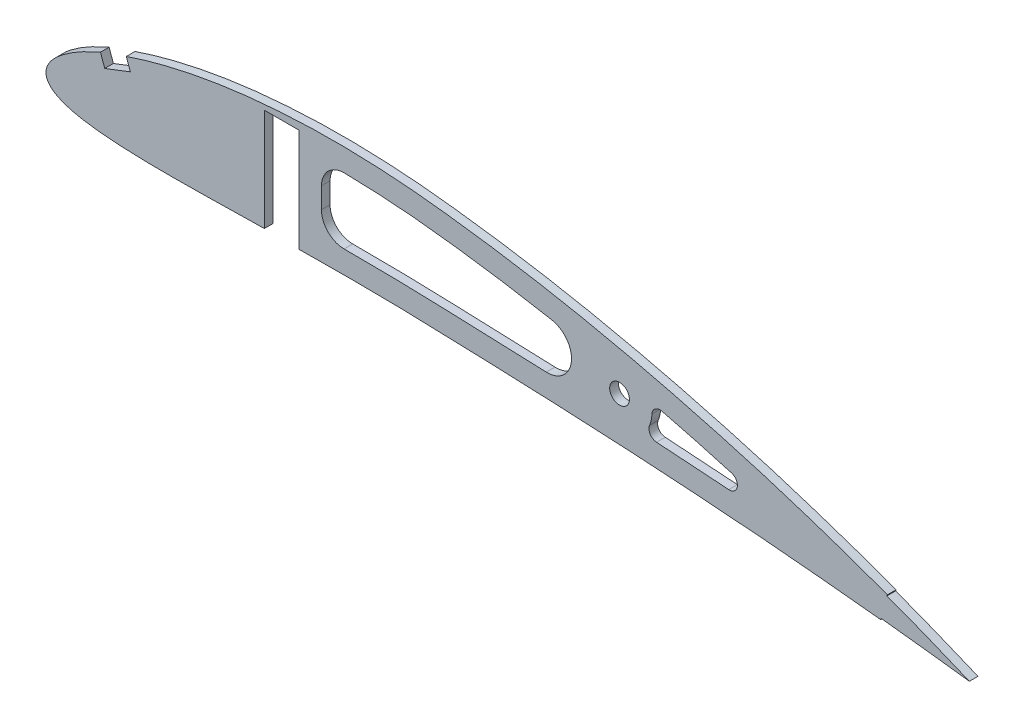
from build123d import *

# Parameters (mm, degrees)
BOSS_EXTRUDE1_DEPTH = 3.4036


with BuildPart() as part:
    # Sketch2 → Boss-Extrude1 (new body)
    with BuildSketch(Plane.XY):
        with BuildLine():
            Line((2535.274805049, 2780.893223643), (2535.274805049, 2740.543361122))
            add(Edge.make_bspline(
                [(2470.766103702, 2768.410457858), (2470.646363815, 2768.358370186), (2470.526712246, 2768.306083676), (2466.913650609, 2766.719977087), (2463.464058775, 2765.044567586), (2457.884399007, 2761.615856063), (2455.608911301, 2760.022433856), (2451.964070041, 2756.675565287), (2450.465728267, 2754.947704601), (2449.289153427, 2751.740968519), (2449.156845546, 2750.440082954), (2449.952027869, 2748.064324238), (2450.809883366, 2747.015100953), (2452.679965619, 2745.532727698), (2453.700996299, 2744.975168564), (2455.737837909, 2744.036068031), (2456.824400221, 2743.665360108), (2460.204069688, 2742.607686032), (2462.568258916, 2742.14769235), (2467.320698583, 2741.37212577), (2469.719825171, 2741.106348945), (2476.948343474, 2740.464859033), (2481.784959026, 2740.2115118), (2491.469537197, 2739.981485553), (2496.312043463, 2739.970228934), (2511.07935418, 2740.05419246), (2520.979134882, 2740.284580717), (2532.350045622, 2740.487337232), (2533.812383917, 2740.515077162), (2535.274805049, 2740.543361122)],
                knots=[14.135708649, 14.135708649, 14.135708649, 14.135708649, 14.151211266, 14.151211266, 14.60418364, 14.60418364, 14.932415743, 14.932415743, 15.199764537, 15.199764537, 15.36293217, 15.36293217, 15.526099802, 15.526099802, 15.662859963, 15.662859963, 15.799620124, 15.799620124, 16.08612483, 16.08612483, 16.372629537, 16.372629537, 16.94563895, 16.94563895, 17.518648363, 17.518648363, 18.689255122, 18.689255122, 18.862005391, 18.862005391, 18.862005391, 18.862005391], degree=3))
            Line((2470.766103702, 2768.410457858), (2472.446764627, 2763.696275266))
            Line((2472.446764627, 2763.696275266), (2482.522098625, 2767.581637536))
            Line((2482.522098625, 2767.581637536), (2480.933451784, 2772.037724527))
            add(Edge.make_bspline(
                [(2780.542520861, 2738.304796601), (2778.297471279, 2739.142019831), (2776.066016024, 2739.994442341), (2771.008325617, 2741.806292996), (2768.18144962, 2742.797529212), (2759.625872554, 2745.848173798), (2753.840462047, 2747.755489462), (2742.238670832, 2751.518458512), (2736.423638946, 2753.367260119), (2724.751445821, 2756.856399923), (2718.882147108, 2758.516262971), (2708.186181794, 2761.475176204), (2703.375708913, 2762.759245987), (2693.688631483, 2765.207206449), (2688.860326868, 2766.449259942), (2679.136671431, 2768.709757651), (2674.257764472, 2769.781661922), (2664.508292075, 2771.926157494), (2659.616809192, 2772.927359188), (2649.829036467, 2774.78903222), (2644.906848922, 2775.708538585), (2635.081058528, 2777.389593315), (2630.134669196, 2778.190987447), (2621.163761513, 2779.504560399), (2617.075894031, 2780.084905445), (2607.950050259, 2781.247235699), (2602.846379088, 2781.820569992), (2592.680866333, 2782.883311443), (2587.583282915, 2783.254135837), (2577.37591978, 2783.863348746), (2572.264211381, 2784.045638297), (2562.055017904, 2784.177120229), (2556.940496788, 2784.131389377), (2546.726345746, 2783.750312928), (2541.620193263, 2783.45333894), (2522.377936656, 2781.865822712), (2508.272533492, 2779.665319702), (2489.975683566, 2774.935155246), (2485.418638544, 2773.582563598), (2480.933451784, 2772.037724527)],
                knots=[1.615826415, 1.615826415, 1.615826415, 1.615826415, 1.89861169, 1.89861169, 2.251569757, 2.251569757, 2.972379576, 2.972379576, 3.693189395, 3.693189395, 4.413999213, 4.413999213, 5.004034628, 5.004034628, 5.594070044, 5.594070044, 6.184105459, 6.184105459, 6.774140874, 6.774140874, 7.364176289, 7.364176289, 7.954211705, 7.954211705, 8.439681123, 8.439681123, 9.044668165, 9.044668165, 9.649655208, 9.649655208, 10.25464225, 10.25464225, 10.859629292, 10.859629292, 11.464616334, 11.464616334, 13.146196735, 13.146196735, 13.708744468, 13.708744468, 13.708744468, 13.708744468], degree=3))
            Line((2780.542520861, 2738.304796601), (2780.366179259, 2737.831929121))
            add(Edge.make_bspline(
                [(2812.811153408, 2724.948946669), (2811.742721472, 2725.395887757), (2810.661000778, 2725.841374778), (2805.162016263, 2728.122214921), (2800.746808293, 2729.909964469), (2791.811027497, 2733.531206027), (2787.390855916, 2735.226750848), (2782.055306735, 2737.205208616), (2781.210779035, 2737.518702972), (2780.366179259, 2737.831929121)],
                knots=[0.240373092, 0.240373092, 0.240373092, 0.240373092, 0.376824745, 0.376824745, 0.94322841, 0.94322841, 1.509632074, 1.509632074, 1.616176715, 1.616176715, 1.616176715, 1.616176715], degree=3))
            add(Edge.make_bspline(
                [(2778.019298543, 2729.044285785), (2779.174843082, 2728.917272472), (2780.33031454, 2728.787786942), (2787.996855373, 2727.910162037), (2794.540348084, 2727.201211519), (2804.935623835, 2725.921900676), (2808.829276968, 2725.401991523), (2812.811153408, 2724.948946669)],
                knots=[28.432746502, 28.432746502, 28.432746502, 28.432746502, 28.569989508, 28.569989508, 29.343340852, 29.343340852, 29.81381441, 29.81381441, 29.81381441, 29.81381441], degree=3))
            Line((2778.019298543, 2729.044285785), (2777.967751396, 2728.520373794))
            add(Edge.make_bspline(
                [(2548.870346536, 2740.268089351), (2549.880763048, 2740.280791201), (2552.565327641, 2740.3160213), (2556.947797606, 2740.376897376), (2562.030529235, 2740.378648073), (2567.173828356, 2740.39381358), (2572.377983544, 2740.409509961), (2577.654631688, 2740.377274897), (2582.978163683, 2740.28236022), (2588.350084988, 2740.236433315), (2593.779620592, 2740.051584682), (2599.307416132, 2739.897493113), (2604.908682597, 2739.718922546), (2610.572157053, 2739.566806388), (2616.257225785, 2739.322295029), (2621.969941233, 2739.17682533), (2627.679751972, 2738.945966374), (2633.40209681, 2738.733903132), (2639.136822152, 2738.529890084), (2644.868715349, 2738.265404796), (2650.588345306, 2738.013120304), (2656.296308508, 2737.780983088), (2661.987661359, 2737.459636088), (2667.671808974, 2737.255951086), (2673.311212153, 2736.903371818), (2678.915236244, 2736.595284197), (2684.481545426, 2736.275807889), (2690.011544993, 2735.973414703), (2695.489391996, 2735.627941228), (2700.902150582, 2735.239398457), (2706.254125464, 2734.868422551), (2711.544005033, 2734.495402469), (2716.748448208, 2734.140509688), (2721.876237554, 2733.749682567), (2726.912041029, 2733.295970625), (2731.881695192, 2732.941864964), (2736.757779223, 2732.505077311), (2741.539063821, 2732.115898579), (2746.215557291, 2731.661834713), (2750.770763986, 2731.236456626), (2755.214578157, 2730.814044563), (2759.534567055, 2730.395435297), (2763.74642736, 2730.008688105), (2767.826055945, 2729.543045622), (2771.793322217, 2729.188977061), (2775.151456937, 2728.792829736), (2777.200029602, 2728.59590913), (2777.967751396, 2728.520373794)],
                knots=[19.396955855, 19.396955855, 19.396955855, 19.396955855, 19.516306022, 19.714059236, 19.914611374, 20.116619667, 20.321540433, 20.529276424, 20.739840618, 20.950404813, 21.163744737, 21.381461041, 21.603553869, 21.825646696, 22.050605171, 22.275615756, 22.500574231, 22.725532706, 22.951950418, 23.17832576, 23.403241591, 23.628157423, 23.853040081, 24.076496408, 24.299895492, 24.520374829, 24.739394295, 24.958413761, 25.174498693, 25.387658693, 25.599358693, 25.808138693, 26.013998693, 26.215483983, 26.415525295, 26.611170743, 26.803912863, 26.993735323, 27.177747459, 27.358840435, 27.534095176, 27.704971321, 27.871468943, 28.033634134, 28.189915523, 28.34186779, 28.432980691, 28.432980691, 28.432980691, 28.432980691], degree=3))
            Line((2548.870346536, 2740.268089351), (2548.863805049, 2740.7884565))
            Line((2548.863805049, 2740.7884565), (2548.863805049, 2780.893223643))
            Line((2548.863805049, 2780.893223643), (2535.274805049, 2780.893223643))
        make_face()
        with BuildLine():
            Line((2557.75380505, 2766.338051462), (2557.753805049, 2758.173668513))
            ThreePointArc((2557.753805049, 2758.173668513), (2560.364468394, 2751.880654039), (2566.663148395, 2749.283689557))
            add(Edge.make_bspline(
                [(2566.663148395, 2749.283689557), (2567.439822141, 2749.28537949), (2568.21832178, 2749.287121889), (2573.587092614, 2749.300089397), (2578.32788588, 2749.244805303), (2585.825022944, 2749.142581173), (2589.036358319, 2749.0997975), (2595.165089719, 2748.908822657), (2598.167336091, 2748.823424784), (2604.257712531, 2748.63670442), (2607.248172017, 2748.558450952), (2612.867384093, 2748.369855698), (2615.291016485, 2748.262041663), (2620.124092488, 2748.110670374), (2622.661869101, 2748.038916534), (2627.621694753, 2747.849865673), (2630.051078266, 2747.753970997), (2637.052732353, 2747.497174336), (2641.706061455, 2747.304365544), (2646.263618968, 2747.103367152)],
                knots=[20.098452244, 20.098452244, 20.098452244, 20.098452244, 20.190362895, 20.190362895, 20.729094517, 20.729094517, 21.088163559, 21.088163559, 21.4472326, 21.4472326, 21.806301641, 21.806301641, 22.096767949, 22.096767949, 22.387234257, 22.387234257, 22.677700566, 22.677700566, 23.217183906, 23.217183906, 23.217183906, 23.217183906], degree=3))
            ThreePointArc((2646.263618968, 2747.103367152), (2656.146412526, 2755.535219019), (2648.426111877, 2765.983314171))
            add(Edge.make_bspline(
                [(2648.426111877, 2765.983314171), (2641.59243129, 2767.255171757), (2634.73375431, 2768.423361294), (2619.325224165, 2770.808594123), (2610.871110121, 2771.941596635), (2595.715687801, 2773.645858456), (2589.314555675, 2774.244707548), (2577.427735136, 2774.945348879), (2572.084779046, 2775.156655575), (2566.761726328, 2775.227269345)],
                knots=[6.961493486, 6.961493486, 6.961493486, 6.961493486, 7.79451578, 7.79451578, 8.825426338, 8.825426338, 9.617156173, 9.617156173, 10.265753337, 10.265753337, 10.265753337, 10.265753337], degree=3))
            ThreePointArc((2566.761726328, 2775.227269345), (2560.399456411, 2772.66578487), (2557.75380505, 2766.338051462))
        make_face(mode=Mode.SUBTRACT)
        with BuildLine():
            ThreePointArc((2718.098293363, 2742.948755457), (2721.456611216, 2745.559527675), (2719.203869949, 2749.167794179))
            add(Edge.make_bspline(
                [(2719.203869949, 2749.167794179), (2714.238092072, 2750.588361117), (2709.231509514, 2751.991354341), (2700.184998092, 2754.408379133), (2696.020099344, 2755.459590051), (2691.817251109, 2756.518477433)],
                knots=[4.060379897, 4.060379897, 4.060379897, 4.060379897, 4.675695902, 4.675695902, 5.188469227, 5.188469227, 5.188469227, 5.188469227], degree=3))
            ThreePointArc((2691.817251109, 2756.518477433), (2689.145550797, 2755.986403674), (2687.869645343, 2753.579507267))
            ThreePointArc((2687.869645343, 2753.579507267), (2687.580669946, 2751.383531079), (2686.916771023, 2749.270463069))
            ThreePointArc((2686.916771023, 2749.270463069), (2687.163429033, 2746.37078989), (2689.668722188, 2744.890097174))
            add(Edge.make_bspline(
                [(2689.668722188, 2744.890097174), (2690.923606701, 2744.817580048), (2692.18303199, 2744.742436563), (2699.065872366, 2744.306846173), (2704.600706314, 2743.894576065), (2712.774522449, 2743.322510938), (2715.42427843, 2743.144951328), (2718.098293363, 2742.948755457)],
                knots=[24.923660459, 24.923660459, 24.923660459, 24.923660459, 25.070608892, 25.070608892, 25.727122197, 25.727122197, 26.039951507, 26.039951507, 26.039951507, 26.039951507], degree=3))
        make_face(mode=Mode.SUBTRACT)
        with BuildLine():
            ThreePointArc((2671.219639614, 2754.142134825), (2675.105839614, 2750.255934825), (2678.992039614, 2754.142134825))
            ThreePointArc((2678.992039614, 2754.142134825), (2675.105839614, 2758.028334825), (2671.219639614, 2754.142134825))
        make_face(mode=Mode.SUBTRACT)
    extrude(amount=BOSS_EXTRUDE1_DEPTH)


solid = part.part
